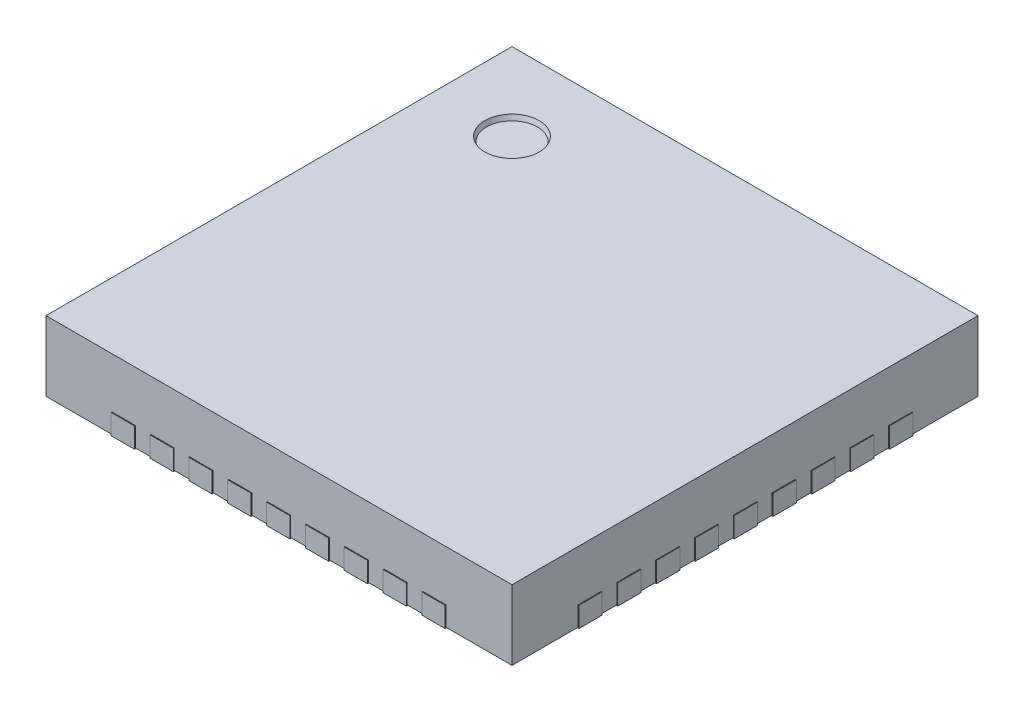
from build123d import *

# Parameters (mm, degrees)
SKETCH1_W                    = 6
SKETCH1_H                    = 6
BOSS_EXTRUDE1_DEPTH          = 0.9
SKETCH3_R                    = 0.35
CUT_EXTRUDE1_DEPTH           = 0.06
CUT_EXTRUDE1_DRAFT           = -20
MIDDLE_PIN_START             = -0.25
SKETCH2_W                    = 0.3
SKETCH2_H                    = 0.01
MIDDLE_PIN_DEPTH             = 0.26
LPATTERN1_COUNT              = 5
LPATTERN1_PITCH              = 0.5
LPATTERN1_COL_COUNT          = 5
LPATTERN1_COL_PITCH          = 0.5
MIRROR1_START                = -0.25
MIRROR1_COPY_1_SKETCH_W      = 0.3
MIRROR1_COPY_1_SKETCH_H      = 0.01
MIRROR1_COPY_1_DEPTH         = 0.26
MIRROR1_COPY_2_SKETCH_W      = 0.3
MIRROR1_COPY_2_SKETCH_H      = 0.01
MIRROR1_COPY_2_DEPTH         = 0.26
MIRROR1_COPY_3_SKETCH_W      = 0.3
MIRROR1_COPY_3_SKETCH_H      = 0.01
MIRROR1_COPY_3_DEPTH         = 0.26
MIRROR1_COPY_4_SKETCH_W      = 0.3
MIRROR1_COPY_4_SKETCH_H      = 0.01
MIRROR1_COPY_4_DEPTH         = 0.26
MIRROR1_COPY_5_SKETCH_W      = 0.3
MIRROR1_COPY_5_SKETCH_H      = 0.01
MIRROR1_COPY_5_DEPTH         = 0.26
MIRROR1_COPY_6_SKETCH_W      = 0.3
MIRROR1_COPY_6_SKETCH_H      = 0.01
MIRROR1_COPY_6_DEPTH         = 0.26
MIRROR1_COPY_7_SKETCH_W      = 0.3
MIRROR1_COPY_7_SKETCH_H      = 0.01
MIRROR1_COPY_7_DEPTH         = 0.26
MIRROR1_COPY_8_SKETCH_W      = 0.3
MIRROR1_COPY_8_SKETCH_H      = 0.01
MIRROR1_COPY_8_DEPTH         = 0.26
CIRPATTERN1_COUNT            = 4
CIRPATTERN1_START            = -0.25
CIRPATTERN1_COPY_1_SKETCH_W  = 0.3
CIRPATTERN1_COPY_1_SKETCH_H  = 0.01
CIRPATTERN1_COPY_1_DEPTH     = 0.26
CIRPATTERN1_COPY_2_SKETCH_W  = 0.3
CIRPATTERN1_COPY_2_SKETCH_H  = 0.01
CIRPATTERN1_COPY_2_DEPTH     = 0.26
CIRPATTERN1_COPY_3_SKETCH_W  = 0.3
CIRPATTERN1_COPY_3_SKETCH_H  = 0.01
CIRPATTERN1_COPY_3_DEPTH     = 0.26
CIRPATTERN1_COPY_4_SKETCH_W  = 0.3
CIRPATTERN1_COPY_4_SKETCH_H  = 0.01
CIRPATTERN1_COPY_4_DEPTH     = 0.26
CIRPATTERN1_COPY_5_SKETCH_W  = 0.3
CIRPATTERN1_COPY_5_SKETCH_H  = 0.01
CIRPATTERN1_COPY_5_DEPTH     = 0.26
CIRPATTERN1_COPY_6_SKETCH_W  = 0.3
CIRPATTERN1_COPY_6_SKETCH_H  = 0.01
CIRPATTERN1_COPY_6_DEPTH     = 0.26
CIRPATTERN1_COPY_7_SKETCH_W  = 0.3
CIRPATTERN1_COPY_7_SKETCH_H  = 0.01
CIRPATTERN1_COPY_7_DEPTH     = 0.26
CIRPATTERN1_COPY_8_SKETCH_W  = 0.3
CIRPATTERN1_COPY_8_SKETCH_H  = 0.01
CIRPATTERN1_COPY_8_DEPTH     = 0.26
CIRPATTERN1_COPY_9_SKETCH_W  = 0.3
CIRPATTERN1_COPY_9_SKETCH_H  = 0.01
CIRPATTERN1_COPY_9_DEPTH     = 0.26
CIRPATTERN1_COPY_10_SKETCH_W = 0.3
CIRPATTERN1_COPY_10_SKETCH_H = 0.01
CIRPATTERN1_COPY_10_DEPTH    = 0.26
CIRPATTERN1_COPY_11_SKETCH_W = 0.3
CIRPATTERN1_COPY_11_SKETCH_H = 0.01
CIRPATTERN1_COPY_11_DEPTH    = 0.26
CIRPATTERN1_COPY_12_SKETCH_W = 0.3
CIRPATTERN1_COPY_12_SKETCH_H = 0.01
CIRPATTERN1_COPY_12_DEPTH    = 0.26
CIRPATTERN1_COPY_13_SKETCH_W = 0.3
CIRPATTERN1_COPY_13_SKETCH_H = 0.01
CIRPATTERN1_COPY_13_DEPTH    = 0.26
CIRPATTERN1_COPY_14_SKETCH_W = 0.3
CIRPATTERN1_COPY_14_SKETCH_H = 0.01
CIRPATTERN1_COPY_14_DEPTH    = 0.26
CIRPATTERN1_COPY_15_SKETCH_W = 0.3
CIRPATTERN1_COPY_15_SKETCH_H = 0.01
CIRPATTERN1_COPY_15_DEPTH    = 0.26
CIRPATTERN1_COPY_16_SKETCH_W = 0.3
CIRPATTERN1_COPY_16_SKETCH_H = 0.01
CIRPATTERN1_COPY_16_DEPTH    = 0.26
BOSS_EXTRUDE3_DEPTH          = 0.01


with BuildPart() as part:
    # Sketch1 → Boss-Extrude1 (new body)
    with BuildSketch(Plane(origin=(0, 0, 0), x_dir=(1, 0, 0), z_dir=(0, 1, 0))):
        Rectangle(SKETCH1_W, SKETCH1_H)
    extrude(amount=BOSS_EXTRUDE1_DEPTH)


with BuildPart() as cut_extrude1_tool:
    # Sketch3 → Cut-Extrude1 (with draft: the straight prism first)
    with BuildSketch(Plane(origin=(0, 0.9, 0), x_dir=(1, 0, 0), z_dir=(0, 1, 0))):
        with Locations((-2, 2)):
            Circle(SKETCH3_R)
    extrude(amount=-CUT_EXTRUDE1_DEPTH)
    # Cut-Extrude1: the draft: its side faces are tilted about the plane it starts from
    cut_extrude1_sides = [cut_extrude1_tool.faces().sort_by_distance(p)[0] for p in [
        (-2.35, 0.87, -2),
    ]]
    draft(cut_extrude1_sides, Plane(origin=(0, 0.9, 0), x_dir=(1, 0, 0), z_dir=(0, 1, 0)), CUT_EXTRUDE1_DRAFT)


with BuildPart() as part_1:
    add(part.part)

    # Cut-Extrude1: cut by cut_extrude1_tool
    add(cut_extrude1_tool.part, mode=Mode.SUBTRACT)

    # Sketch2 → middle_pin (add)
    with BuildSketch(Plane.XZ.offset(MIDDLE_PIN_START)):
        with BuildLine():
            Line((0.15, 3), (-0.15, 3))
            Line((-0.15, 3), (-0.15, 2.484382319))
            ThreePointArc((-0.15, 2.484382319), (-0.097430695, 2.395140657), (0, 2.36))
            ThreePointArc((0, 2.36), (0.097430695, 2.395140657), (0.15, 2.484382319))
            Line((0.15, 2.484382319), (0.15, 3))
        make_face()
        with Locations((0, 3.005)):
            Rectangle(SKETCH2_W, SKETCH2_H)
    middle_pin = extrude(amount=MIDDLE_PIN_DEPTH)

    # LPattern1: middle_pin ×5
    with Locations(*[(-i * LPATTERN1_PITCH, 0, 0) for i in range(1, LPATTERN1_COUNT)]):
        add(middle_pin)

    # LPattern1 col: middle_pin ×5
    with Locations(*[(i * LPATTERN1_COL_PITCH, 0, 0) for i in range(1, LPATTERN1_COL_COUNT)]):
        add(middle_pin)

    # Mirror1: middle_pin across plane
    add(middle_pin.mirror(Plane.XY))

    # Mirror1 copy 1 sketch → Mirror1 copy 1 (add)
    with BuildSketch(Plane(origin=(-0.5, 0, 0), x_dir=(1, 0, 0), z_dir=(0, -1, 0)).offset(MIRROR1_START)):
        with BuildLine():
            Line((0.15, -3), (-0.15, -3))
            Line((-0.15, -3), (-0.15, -2.484382319))
            ThreePointArc((-0.15, -2.484382319), (-0.097430695, -2.395140657), (0, -2.36))
            ThreePointArc((0, -2.36), (0.097430695, -2.395140657), (0.15, -2.484382319))
            Line((0.15, -2.484382319), (0.15, -3))
        make_face()
        with Locations((0, -3.005)):
            Rectangle(MIRROR1_COPY_1_SKETCH_W, MIRROR1_COPY_1_SKETCH_H)
    extrude(amount=MIRROR1_COPY_1_DEPTH)

    # Mirror1 copy 2 sketch → Mirror1 copy 2 (add)
    with BuildSketch(Plane(origin=(-1, 0, 0), x_dir=(1, 0, 0), z_dir=(0, -1, 0)).offset(MIRROR1_START)):
        with BuildLine():
            Line((0.15, -3), (-0.15, -3))
            Line((-0.15, -3), (-0.15, -2.484382319))
            ThreePointArc((-0.15, -2.484382319), (-0.097430695, -2.395140657), (0, -2.36))
            ThreePointArc((0, -2.36), (0.097430695, -2.395140657), (0.15, -2.484382319))
            Line((0.15, -2.484382319), (0.15, -3))
        make_face()
        with Locations((0, -3.005)):
            Rectangle(MIRROR1_COPY_2_SKETCH_W, MIRROR1_COPY_2_SKETCH_H)
    extrude(amount=MIRROR1_COPY_2_DEPTH)

    # Mirror1 copy 3 sketch → Mirror1 copy 3 (add)
    with BuildSketch(Plane(origin=(-1.5, 0, 0), x_dir=(1, 0, 0), z_dir=(0, -1, 0)).offset(MIRROR1_START)):
        with BuildLine():
            Line((0.15, -3), (-0.15, -3))
            Line((-0.15, -3), (-0.15, -2.484382319))
            ThreePointArc((-0.15, -2.484382319), (-0.097430695, -2.395140657), (0, -2.36))
            ThreePointArc((0, -2.36), (0.097430695, -2.395140657), (0.15, -2.484382319))
            Line((0.15, -2.484382319), (0.15, -3))
        make_face()
        with Locations((0, -3.005)):
            Rectangle(MIRROR1_COPY_3_SKETCH_W, MIRROR1_COPY_3_SKETCH_H)
    extrude(amount=MIRROR1_COPY_3_DEPTH)

    # Mirror1 copy 4 sketch → Mirror1 copy 4 (add)
    with BuildSketch(Plane(origin=(-2, 0, 0), x_dir=(1, 0, 0), z_dir=(0, -1, 0)).offset(MIRROR1_START)):
        with BuildLine():
            Line((0.15, -3), (-0.15, -3))
            Line((-0.15, -3), (-0.15, -2.484382319))
            ThreePointArc((-0.15, -2.484382319), (-0.097430695, -2.395140657), (0, -2.36))
            ThreePointArc((0, -2.36), (0.097430695, -2.395140657), (0.15, -2.484382319))
            Line((0.15, -2.484382319), (0.15, -3))
        make_face()
        with Locations((0, -3.005)):
            Rectangle(MIRROR1_COPY_4_SKETCH_W, MIRROR1_COPY_4_SKETCH_H)
    extrude(amount=MIRROR1_COPY_4_DEPTH)

    # Mirror1 copy 5 sketch → Mirror1 copy 5 (add)
    with BuildSketch(Plane(origin=(0.5, 0, 0), x_dir=(1, 0, 0), z_dir=(0, -1, 0)).offset(MIRROR1_START)):
        with BuildLine():
            Line((0.15, -3), (-0.15, -3))
            Line((-0.15, -3), (-0.15, -2.484382319))
            ThreePointArc((-0.15, -2.484382319), (-0.097430695, -2.395140657), (0, -2.36))
            ThreePointArc((0, -2.36), (0.097430695, -2.395140657), (0.15, -2.484382319))
            Line((0.15, -2.484382319), (0.15, -3))
        make_face()
        with Locations((0, -3.005)):
            Rectangle(MIRROR1_COPY_5_SKETCH_W, MIRROR1_COPY_5_SKETCH_H)
    extrude(amount=MIRROR1_COPY_5_DEPTH)

    # Mirror1 copy 6 sketch → Mirror1 copy 6 (add)
    with BuildSketch(Plane(origin=(1, 0, 0), x_dir=(1, 0, 0), z_dir=(0, -1, 0)).offset(MIRROR1_START)):
        with BuildLine():
            Line((0.15, -3), (-0.15, -3))
            Line((-0.15, -3), (-0.15, -2.484382319))
            ThreePointArc((-0.15, -2.484382319), (-0.097430695, -2.395140657), (0, -2.36))
            ThreePointArc((0, -2.36), (0.097430695, -2.395140657), (0.15, -2.484382319))
            Line((0.15, -2.484382319), (0.15, -3))
        make_face()
        with Locations((0, -3.005)):
            Rectangle(MIRROR1_COPY_6_SKETCH_W, MIRROR1_COPY_6_SKETCH_H)
    extrude(amount=MIRROR1_COPY_6_DEPTH)

    # Mirror1 copy 7 sketch → Mirror1 copy 7 (add)
    with BuildSketch(Plane(origin=(1.5, 0, 0), x_dir=(1, 0, 0), z_dir=(0, -1, 0)).offset(MIRROR1_START)):
        with BuildLine():
            Line((0.15, -3), (-0.15, -3))
            Line((-0.15, -3), (-0.15, -2.484382319))
            ThreePointArc((-0.15, -2.484382319), (-0.097430695, -2.395140657), (0, -2.36))
            ThreePointArc((0, -2.36), (0.097430695, -2.395140657), (0.15, -2.484382319))
            Line((0.15, -2.484382319), (0.15, -3))
        make_face()
        with Locations((0, -3.005)):
            Rectangle(MIRROR1_COPY_7_SKETCH_W, MIRROR1_COPY_7_SKETCH_H)
    extrude(amount=MIRROR1_COPY_7_DEPTH)

    # Mirror1 copy 8 sketch → Mirror1 copy 8 (add)
    with BuildSketch(Plane(origin=(2, 0, 0), x_dir=(1, 0, 0), z_dir=(0, -1, 0)).offset(MIRROR1_START)):
        with BuildLine():
            Line((0.15, -3), (-0.15, -3))
            Line((-0.15, -3), (-0.15, -2.484382319))
            ThreePointArc((-0.15, -2.484382319), (-0.097430695, -2.395140657), (0, -2.36))
            ThreePointArc((0, -2.36), (0.097430695, -2.395140657), (0.15, -2.484382319))
            Line((0.15, -2.484382319), (0.15, -3))
        make_face()
        with Locations((0, -3.005)):
            Rectangle(MIRROR1_COPY_8_SKETCH_W, MIRROR1_COPY_8_SKETCH_H)
    extrude(amount=MIRROR1_COPY_8_DEPTH)

    # CirPattern1: middle_pin ×4 about axis, 1 skipped
    cirpattern1_axis = Axis((0, 0, 0), (0, 1, 0))
    add([middle_pin.rotate(cirpattern1_axis, i * 360 / CIRPATTERN1_COUNT) for i in range(1, CIRPATTERN1_COUNT) if i not in (2,)])

    # CirPattern1 copy 1 sketch → CirPattern1 copy 1 (add)
    with BuildSketch(Plane(origin=(0, 0, 0.5), x_dir=(0, 0, -1), z_dir=(0, -1, 0)).offset(CIRPATTERN1_START)):
        with BuildLine():
            Line((0.15, 3), (-0.15, 3))
            Line((-0.15, 3), (-0.15, 2.484382319))
            ThreePointArc((-0.15, 2.484382319), (-0.097430695, 2.395140657), (0, 2.36))
            ThreePointArc((0, 2.36), (0.097430695, 2.395140657), (0.15, 2.484382319))
            Line((0.15, 2.484382319), (0.15, 3))
        make_face()
        with Locations((0, 3.005)):
            Rectangle(CIRPATTERN1_COPY_1_SKETCH_W, CIRPATTERN1_COPY_1_SKETCH_H)
    extrude(amount=CIRPATTERN1_COPY_1_DEPTH)

    # CirPattern1 copy 2 sketch → CirPattern1 copy 2 (add)
    with BuildSketch(Plane(origin=(0, 0, -0.5), x_dir=(0, 0, 1), z_dir=(0, -1, 0)).offset(CIRPATTERN1_START)):
        with BuildLine():
            Line((0.15, 3), (-0.15, 3))
            Line((-0.15, 3), (-0.15, 2.484382319))
            ThreePointArc((-0.15, 2.484382319), (-0.097430695, 2.395140657), (0, 2.36))
            ThreePointArc((0, 2.36), (0.097430695, 2.395140657), (0.15, 2.484382319))
            Line((0.15, 2.484382319), (0.15, 3))
        make_face()
        with Locations((0, 3.005)):
            Rectangle(CIRPATTERN1_COPY_2_SKETCH_W, CIRPATTERN1_COPY_2_SKETCH_H)
    extrude(amount=CIRPATTERN1_COPY_2_DEPTH)

    # CirPattern1 copy 3 sketch → CirPattern1 copy 3 (add)
    with BuildSketch(Plane(origin=(0, 0, 1), x_dir=(0, 0, -1), z_dir=(0, -1, 0)).offset(CIRPATTERN1_START)):
        with BuildLine():
            Line((0.15, 3), (-0.15, 3))
            Line((-0.15, 3), (-0.15, 2.484382319))
            ThreePointArc((-0.15, 2.484382319), (-0.097430695, 2.395140657), (0, 2.36))
            ThreePointArc((0, 2.36), (0.097430695, 2.395140657), (0.15, 2.484382319))
            Line((0.15, 2.484382319), (0.15, 3))
        make_face()
        with Locations((0, 3.005)):
            Rectangle(CIRPATTERN1_COPY_3_SKETCH_W, CIRPATTERN1_COPY_3_SKETCH_H)
    extrude(amount=CIRPATTERN1_COPY_3_DEPTH)

    # CirPattern1 copy 4 sketch → CirPattern1 copy 4 (add)
    with BuildSketch(Plane(origin=(0, 0, -1), x_dir=(0, 0, 1), z_dir=(0, -1, 0)).offset(CIRPATTERN1_START)):
        with BuildLine():
            Line((0.15, 3), (-0.15, 3))
            Line((-0.15, 3), (-0.15, 2.484382319))
            ThreePointArc((-0.15, 2.484382319), (-0.097430695, 2.395140657), (0, 2.36))
            ThreePointArc((0, 2.36), (0.097430695, 2.395140657), (0.15, 2.484382319))
            Line((0.15, 2.484382319), (0.15, 3))
        make_face()
        with Locations((0, 3.005)):
            Rectangle(CIRPATTERN1_COPY_4_SKETCH_W, CIRPATTERN1_COPY_4_SKETCH_H)
    extrude(amount=CIRPATTERN1_COPY_4_DEPTH)

    # CirPattern1 copy 5 sketch → CirPattern1 copy 5 (add)
    with BuildSketch(Plane(origin=(0, 0, 1.5), x_dir=(0, 0, -1), z_dir=(0, -1, 0)).offset(CIRPATTERN1_START)):
        with BuildLine():
            Line((0.15, 3), (-0.15, 3))
            Line((-0.15, 3), (-0.15, 2.484382319))
            ThreePointArc((-0.15, 2.484382319), (-0.097430695, 2.395140657), (0, 2.36))
            ThreePointArc((0, 2.36), (0.097430695, 2.395140657), (0.15, 2.484382319))
            Line((0.15, 2.484382319), (0.15, 3))
        make_face()
        with Locations((0, 3.005)):
            Rectangle(CIRPATTERN1_COPY_5_SKETCH_W, CIRPATTERN1_COPY_5_SKETCH_H)
    extrude(amount=CIRPATTERN1_COPY_5_DEPTH)

    # CirPattern1 copy 6 sketch → CirPattern1 copy 6 (add)
    with BuildSketch(Plane(origin=(0, 0, -1.5), x_dir=(0, 0, 1), z_dir=(0, -1, 0)).offset(CIRPATTERN1_START)):
        with BuildLine():
            Line((0.15, 3), (-0.15, 3))
            Line((-0.15, 3), (-0.15, 2.484382319))
            ThreePointArc((-0.15, 2.484382319), (-0.097430695, 2.395140657), (0, 2.36))
            ThreePointArc((0, 2.36), (0.097430695, 2.395140657), (0.15, 2.484382319))
            Line((0.15, 2.484382319), (0.15, 3))
        make_face()
        with Locations((0, 3.005)):
            Rectangle(CIRPATTERN1_COPY_6_SKETCH_W, CIRPATTERN1_COPY_6_SKETCH_H)
    extrude(amount=CIRPATTERN1_COPY_6_DEPTH)

    # CirPattern1 copy 7 sketch → CirPattern1 copy 7 (add)
    with BuildSketch(Plane(origin=(0, 0, 2), x_dir=(0, 0, -1), z_dir=(0, -1, 0)).offset(CIRPATTERN1_START)):
        with BuildLine():
            Line((0.15, 3), (-0.15, 3))
            Line((-0.15, 3), (-0.15, 2.484382319))
            ThreePointArc((-0.15, 2.484382319), (-0.097430695, 2.395140657), (0, 2.36))
            ThreePointArc((0, 2.36), (0.097430695, 2.395140657), (0.15, 2.484382319))
            Line((0.15, 2.484382319), (0.15, 3))
        make_face()
        with Locations((0, 3.005)):
            Rectangle(CIRPATTERN1_COPY_7_SKETCH_W, CIRPATTERN1_COPY_7_SKETCH_H)
    extrude(amount=CIRPATTERN1_COPY_7_DEPTH)

    # CirPattern1 copy 8 sketch → CirPattern1 copy 8 (add)
    with BuildSketch(Plane(origin=(0, 0, -2), x_dir=(0, 0, 1), z_dir=(0, -1, 0)).offset(CIRPATTERN1_START)):
        with BuildLine():
            Line((0.15, 3), (-0.15, 3))
            Line((-0.15, 3), (-0.15, 2.484382319))
            ThreePointArc((-0.15, 2.484382319), (-0.097430695, 2.395140657), (0, 2.36))
            ThreePointArc((0, 2.36), (0.097430695, 2.395140657), (0.15, 2.484382319))
            Line((0.15, 2.484382319), (0.15, 3))
        make_face()
        with Locations((0, 3.005)):
            Rectangle(CIRPATTERN1_COPY_8_SKETCH_W, CIRPATTERN1_COPY_8_SKETCH_H)
    extrude(amount=CIRPATTERN1_COPY_8_DEPTH)

    # CirPattern1 copy 9 sketch → CirPattern1 copy 9 (add)
    with BuildSketch(Plane(origin=(0, 0, -0.5), x_dir=(0, 0, -1), z_dir=(0, -1, 0)).offset(CIRPATTERN1_START)):
        with BuildLine():
            Line((0.15, 3), (-0.15, 3))
            Line((-0.15, 3), (-0.15, 2.484382319))
            ThreePointArc((-0.15, 2.484382319), (-0.097430695, 2.395140657), (0, 2.36))
            ThreePointArc((0, 2.36), (0.097430695, 2.395140657), (0.15, 2.484382319))
            Line((0.15, 2.484382319), (0.15, 3))
        make_face()
        with Locations((0, 3.005)):
            Rectangle(CIRPATTERN1_COPY_9_SKETCH_W, CIRPATTERN1_COPY_9_SKETCH_H)
    extrude(amount=CIRPATTERN1_COPY_9_DEPTH)

    # CirPattern1 copy 10 sketch → CirPattern1 copy 10 (add)
    with BuildSketch(Plane(origin=(0, 0, 0.5), x_dir=(0, 0, 1), z_dir=(0, -1, 0)).offset(CIRPATTERN1_START)):
        with BuildLine():
            Line((0.15, 3), (-0.15, 3))
            Line((-0.15, 3), (-0.15, 2.484382319))
            ThreePointArc((-0.15, 2.484382319), (-0.097430695, 2.395140657), (0, 2.36))
            ThreePointArc((0, 2.36), (0.097430695, 2.395140657), (0.15, 2.484382319))
            Line((0.15, 2.484382319), (0.15, 3))
        make_face()
        with Locations((0, 3.005)):
            Rectangle(CIRPATTERN1_COPY_10_SKETCH_W, CIRPATTERN1_COPY_10_SKETCH_H)
    extrude(amount=CIRPATTERN1_COPY_10_DEPTH)

    # CirPattern1 copy 11 sketch → CirPattern1 copy 11 (add)
    with BuildSketch(Plane(origin=(0, 0, -1), x_dir=(0, 0, -1), z_dir=(0, -1, 0)).offset(CIRPATTERN1_START)):
        with BuildLine():
            Line((0.15, 3), (-0.15, 3))
            Line((-0.15, 3), (-0.15, 2.484382319))
            ThreePointArc((-0.15, 2.484382319), (-0.097430695, 2.395140657), (0, 2.36))
            ThreePointArc((0, 2.36), (0.097430695, 2.395140657), (0.15, 2.484382319))
            Line((0.15, 2.484382319), (0.15, 3))
        make_face()
        with Locations((0, 3.005)):
            Rectangle(CIRPATTERN1_COPY_11_SKETCH_W, CIRPATTERN1_COPY_11_SKETCH_H)
    extrude(amount=CIRPATTERN1_COPY_11_DEPTH)

    # CirPattern1 copy 12 sketch → CirPattern1 copy 12 (add)
    with BuildSketch(Plane(origin=(0, 0, 1), x_dir=(0, 0, 1), z_dir=(0, -1, 0)).offset(CIRPATTERN1_START)):
        with BuildLine():
            Line((0.15, 3), (-0.15, 3))
            Line((-0.15, 3), (-0.15, 2.484382319))
            ThreePointArc((-0.15, 2.484382319), (-0.097430695, 2.395140657), (0, 2.36))
            ThreePointArc((0, 2.36), (0.097430695, 2.395140657), (0.15, 2.484382319))
            Line((0.15, 2.484382319), (0.15, 3))
        make_face()
        with Locations((0, 3.005)):
            Rectangle(CIRPATTERN1_COPY_12_SKETCH_W, CIRPATTERN1_COPY_12_SKETCH_H)
    extrude(amount=CIRPATTERN1_COPY_12_DEPTH)

    # CirPattern1 copy 13 sketch → CirPattern1 copy 13 (add)
    with BuildSketch(Plane(origin=(0, 0, -1.5), x_dir=(0, 0, -1), z_dir=(0, -1, 0)).offset(CIRPATTERN1_START)):
        with BuildLine():
            Line((0.15, 3), (-0.15, 3))
            Line((-0.15, 3), (-0.15, 2.484382319))
            ThreePointArc((-0.15, 2.484382319), (-0.097430695, 2.395140657), (0, 2.36))
            ThreePointArc((0, 2.36), (0.097430695, 2.395140657), (0.15, 2.484382319))
            Line((0.15, 2.484382319), (0.15, 3))
        make_face()
        with Locations((0, 3.005)):
            Rectangle(CIRPATTERN1_COPY_13_SKETCH_W, CIRPATTERN1_COPY_13_SKETCH_H)
    extrude(amount=CIRPATTERN1_COPY_13_DEPTH)

    # CirPattern1 copy 14 sketch → CirPattern1 copy 14 (add)
    with BuildSketch(Plane(origin=(0, 0, 1.5), x_dir=(0, 0, 1), z_dir=(0, -1, 0)).offset(CIRPATTERN1_START)):
        with BuildLine():
            Line((0.15, 3), (-0.15, 3))
            Line((-0.15, 3), (-0.15, 2.484382319))
            ThreePointArc((-0.15, 2.484382319), (-0.097430695, 2.395140657), (0, 2.36))
            ThreePointArc((0, 2.36), (0.097430695, 2.395140657), (0.15, 2.484382319))
            Line((0.15, 2.484382319), (0.15, 3))
        make_face()
        with Locations((0, 3.005)):
            Rectangle(CIRPATTERN1_COPY_14_SKETCH_W, CIRPATTERN1_COPY_14_SKETCH_H)
    extrude(amount=CIRPATTERN1_COPY_14_DEPTH)

    # CirPattern1 copy 15 sketch → CirPattern1 copy 15 (add)
    with BuildSketch(Plane(origin=(0, 0, -2), x_dir=(0, 0, -1), z_dir=(0, -1, 0)).offset(CIRPATTERN1_START)):
        with BuildLine():
            Line((0.15, 3), (-0.15, 3))
            Line((-0.15, 3), (-0.15, 2.484382319))
            ThreePointArc((-0.15, 2.484382319), (-0.097430695, 2.395140657), (0, 2.36))
            ThreePointArc((0, 2.36), (0.097430695, 2.395140657), (0.15, 2.484382319))
            Line((0.15, 2.484382319), (0.15, 3))
        make_face()
        with Locations((0, 3.005)):
            Rectangle(CIRPATTERN1_COPY_15_SKETCH_W, CIRPATTERN1_COPY_15_SKETCH_H)
    extrude(amount=CIRPATTERN1_COPY_15_DEPTH)

    # CirPattern1 copy 16 sketch → CirPattern1 copy 16 (add)
    with BuildSketch(Plane(origin=(0, 0, 2), x_dir=(0, 0, 1), z_dir=(0, -1, 0)).offset(CIRPATTERN1_START)):
        with BuildLine():
            Line((0.15, 3), (-0.15, 3))
            Line((-0.15, 3), (-0.15, 2.484382319))
            ThreePointArc((-0.15, 2.484382319), (-0.097430695, 2.395140657), (0, 2.36))
            ThreePointArc((0, 2.36), (0.097430695, 2.395140657), (0.15, 2.484382319))
            Line((0.15, 2.484382319), (0.15, 3))
        make_face()
        with Locations((0, 3.005)):
            Rectangle(CIRPATTERN1_COPY_16_SKETCH_W, CIRPATTERN1_COPY_16_SKETCH_H)
    extrude(amount=CIRPATTERN1_COPY_16_DEPTH)

    # Sketch5 → Boss-Extrude3 (add)
    with BuildSketch(Plane.XZ):
        with BuildLine():
            Line((2.075, 2.075), (-2.075, 2.075))
            Line((-2.075, 2.075), (-2.075, -1.883026302))
            ThreePointArc((-2.075, -1.883026302), (-1.939254097, -1.939254097), (-1.883026302, -2.075))
            Line((-1.883026302, -2.075), (2.075, -2.075))
            Line((2.075, -2.075), (2.075, 2.075))
        make_face()
    extrude(amount=BOSS_EXTRUDE3_DEPTH)


solid = part_1.part
